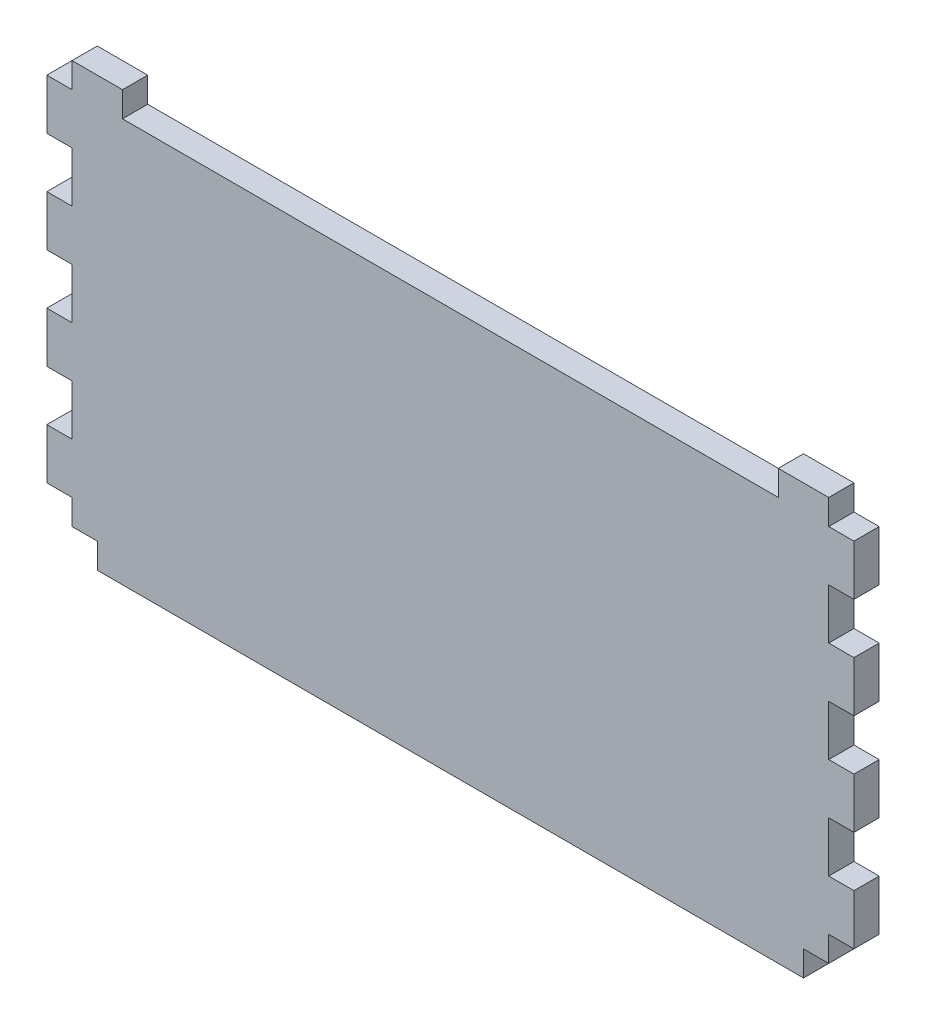
from build123d import *

# Parameters (mm, degrees)
BOSS_EXTRU_1_DEPTH      = 5
ESQUISSE2_W             = 130
ESQUISSE2_H             = 5
ENL_V_MAT_EXTRU_1_DEPTH = 5
ESQUISSE3_W             = 140
ESQUISSE3_H             = 5
BOSS_EXTRU_2_DEPTH      = 5


with BuildPart() as part:
    # Esquisse1 → Boss.-Extru.1 (new body)
    with BuildSketch(Plane.XY):
        Polygon((-83.248069132, -165.097223543), (-83.248069132, -160.097223543), (-88.248069132, -160.097223543), (-88.248069132, -150.097223543), (-83.248069132, -150.097223543), (-83.248069132, -140.097223543), (-88.248069132, -140.097223543), (-88.248069132, -130.097223543), (-83.248069132, -130.097223543), (-83.248069132, -120.097223543), (-88.248069132, -120.097223543), (-88.248069132, -110.097223543), (-83.248069132, -110.097223543), (-83.248069132, -100.097223543), (-88.248069132, -100.097223543), (-88.248069132, -90.097223543), (-83.248069132, -90.097223543), (-83.248069132, -85.097223543), (66.751930868, -85.097223543), (66.751930868, -90.097223543), (71.751930868, -90.097223543), (71.751930868, -100.097223543), (66.751930868, -100.097223543), (66.751930868, -110.097223543), (71.751930868, -110.097223543), (71.751930868, -120.097223543), (66.751930868, -120.097223543), (66.751930868, -130.097223543), (71.751930868, -130.097223543), (71.751930868, -140.097223543), (66.751930868, -140.097223543), (66.751930868, -150.097223543), (71.751930868, -150.097223543), (71.751930868, -160.097223543), (66.751930868, -160.097223543), (66.751930868, -165.097223543), align=None)
    extrude(amount=BOSS_EXTRU_1_DEPTH)

    # Esquisse2 → Enlèv. mat.-Extru.1 (cut)
    with BuildSketch(Plane.XY.offset(5)):
        with Locations((-8.248069132, -87.597223543)):
            Rectangle(ESQUISSE2_W, ESQUISSE2_H)
    extrude(amount=-ENL_V_MAT_EXTRU_1_DEPTH, mode=Mode.SUBTRACT)

    # Esquisse3 → Boss.-Extru.2 (add)
    with BuildSketch(Plane.XY.offset(5)):
        with Locations((-8.248069132, -167.597223543)):
            Rectangle(ESQUISSE3_W, ESQUISSE3_H)
    extrude(amount=-BOSS_EXTRU_2_DEPTH)


solid = part.part
